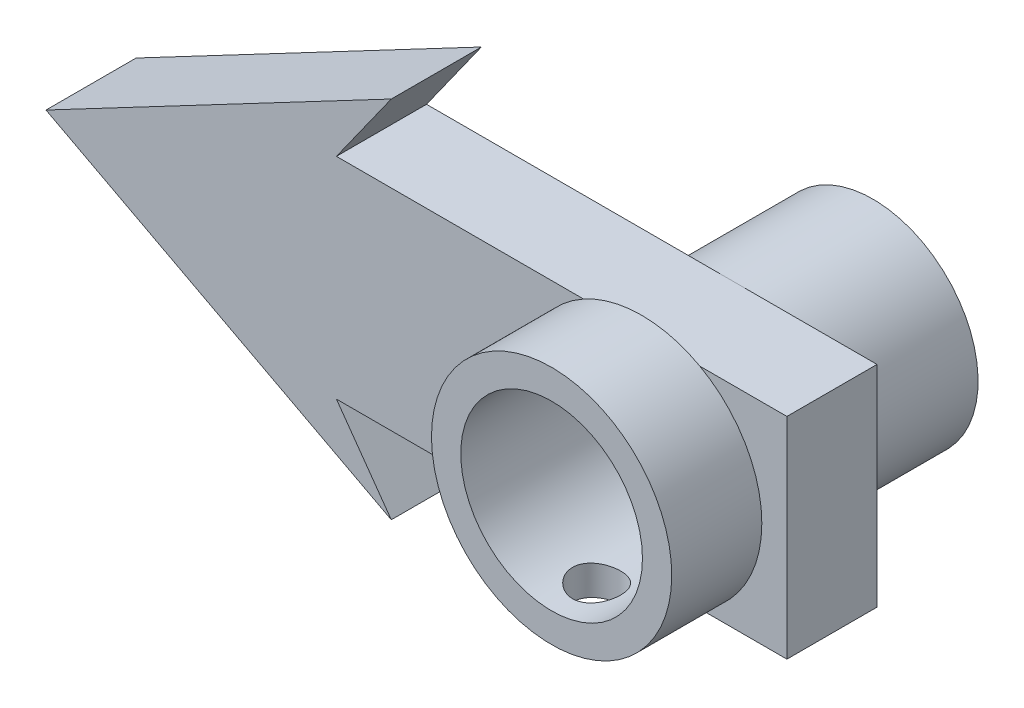
from build123d import *

# Parameters (mm, degrees)
BOSS_EXTRUDE1_DEPTH     = 3
SKETCH8_R               = 4
BOSS_EXTRUDE4_DEPTH     = 3
CUT_EXTRUDE5_REACH      = 42.577
SKETCH9_R               = 3.025
CUT_EXTRUDE6_REACH      = 42.577
CUT_EXTRUDE6_END_RADIUS = 4
SKETCH10_R              = 0.8
SKETCH11_R              = 3.5
BOSS_EXTRUDE5_DEPTH     = 4.7
SKETCH12_R              = 2
CUT_EXTRUDE7_DEPTH      = 1.95
SKETCH13_W              = 3
SKETCH13_H              = 7
CUT_EXTRUDE8_DEPTH      = 15


with BuildPart() as part:
    # Sketch3 → Boss-Extrude1 (new body)
    with BuildSketch(Plane.XY):
        Polygon((0, 0), (11.497632607, 6.066666667), (9.670080369, 3.5), (39.670080369, 3.5), (39.670080369, -3.5), (9.670080369, -3.5), (11.497632607, -6.066666667), align=None)
    extrude(amount=BOSS_EXTRUDE1_DEPTH)

    # Sketch8 → Boss-Extrude4 (add)
    with BuildSketch(Plane.XY.offset(3)):
        with Locations(Location((19.835040185, 0, 0), (0, 0, 118.955024372))):
            Circle(SKETCH8_R)
    extrude(amount=BOSS_EXTRUDE4_DEPTH)

    # Sketch9 → Cut-Extrude5 (cut, up to next)
    with BuildSketch(Plane.XY.offset(6), mode=Mode.PRIVATE) as cut_extrude5_sk1:
        with Locations((19.835040185, 0)):
            Circle(SKETCH9_R)
    cut_extrude5_tool1 = extrude(cut_extrude5_sk1.sketch, amount=-CUT_EXTRUDE5_REACH, mode=Mode.PRIVATE) & part.part
    add(cut_extrude5_tool1.solids().sort_by_distance((19.83504, 0, 6))[0], mode=Mode.SUBTRACT)

    # Cut-Extrude6: up to this cylinder (the profile starts inside it)
    cut_extrude6_end = Plane(origin=(19.835040185, 0, 4.5), z_dir=(0, 0, -1)) * Cylinder(CUT_EXTRUDE6_END_RADIUS, 94.154, mode=Mode.PRIVATE)
    # Sketch10 → Cut-Extrude6 (cut, up to the surface)
    with BuildSketch(Plane(origin=(0, 0, 0), x_dir=(1, 0, 0), z_dir=(0, 1, 0)), mode=Mode.PRIVATE) as cut_extrude6_sk1:
        with Locations(Location((19.835040185, -4.5, 0), (0, 0, 270))):
            Circle(SKETCH10_R)
    cut_extrude6_tool1 = extrude(cut_extrude6_sk1.sketch, amount=-CUT_EXTRUDE6_REACH, mode=Mode.PRIVATE) & cut_extrude6_end
    add(cut_extrude6_tool1.solids().sort_by_distance((19.83504, 0, 4.5))[0], mode=Mode.SUBTRACT)

    # Sketch11 → Boss-Extrude5 (add)
    with BuildSketch(Plane(origin=(0, 0, 0), x_dir=(-1, 0, 0), z_dir=(0, 0, -1))):
        with Locations(Location((-19.835040185, 0, 0), (0, 0, 270))):
            Circle(SKETCH11_R)
    extrude(amount=BOSS_EXTRUDE5_DEPTH)

    # Sketch12 → Cut-Extrude7 (cut)
    with BuildSketch(Plane(origin=(0, 0, -4.7), x_dir=(-1, 0, 0), z_dir=(0, 0, -1))):
        with Locations((-19.835040185, 0)):
            Circle(SKETCH12_R)
    extrude(amount=-CUT_EXTRUDE7_DEPTH, mode=Mode.SUBTRACT)

    # Sketch13 → Cut-Extrude8 (cut)
    with BuildSketch(Plane(origin=(39.670080369, 0, 0), x_dir=(0, 0, -1), z_dir=(1, 0, 0))):
        with Locations((-1.5, 0)):
            Rectangle(SKETCH13_W, SKETCH13_H)
    extrude(amount=-CUT_EXTRUDE8_DEPTH, mode=Mode.SUBTRACT)


solid = part.part
